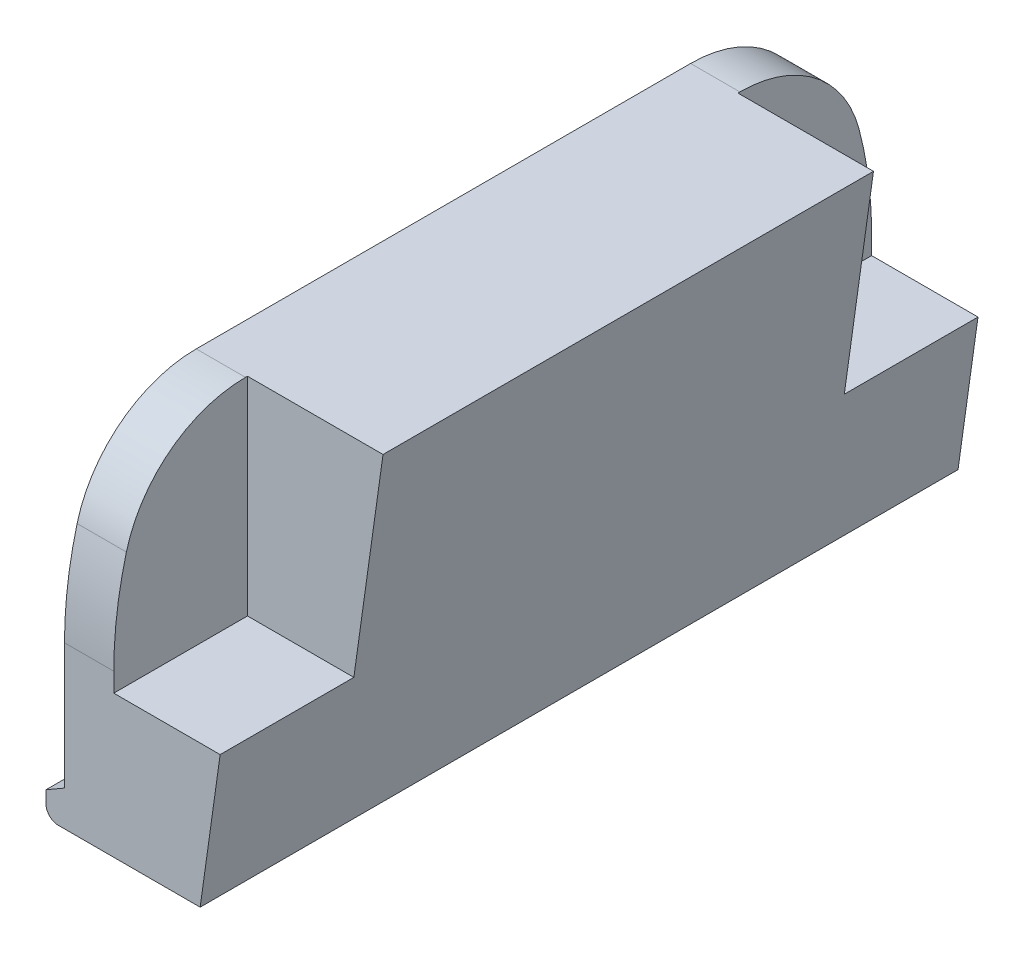
from build123d import *

# Parameters (mm, degrees)
BOSS_EXTRUDE1_DEPTH = 12.3
SKETCH2_W           = 2.2
SKETCH2_H           = 2.17
CUT_EXTRUDE1_DEPTH  = 4.2
CUT_EXTRUDE3_DEPTH  = 0.8
SKETCH5_W           = 3
SKETCH5_H           = 1
BOSS_EXTRUDE2_DEPTH = 0.55
BOSS_EXTRUDE3_DEPTH = 3
SKETCH7_W           = 13.013136742
SKETCH7_H           = 0.83
CUT_EXTRUDE4_DEPTH  = 15.056708453
FILLET1_R           = 2
CUT_EXTRUDE5_DEPTH  = 14.785193345


with BuildPart() as part:
    # Sketch1 → Boss-Extrude1 (new body)
    with BuildSketch(Plane.XY):
        with BuildLine():
            Line((0, 0), (0.299997713, 0.173208719))
            Line((0.299997713, 0.173208719), (0.299997713, 1.781598719))
            Line((0.299997713, 1.781598719), (0.299997713, 6.107458719))
            Line((0.299997713, 6.107458719), (3.299997713, 6.107458719))
            Line((3.299997713, 6.107458719), (3.299997713, 0.646828719))
            Line((3.299997713, 0.646828719), (3.299997713, -0.4))
            Line((3.299997713, -0.4), (0.2, -0.4))
            ThreePointArc((0.2, -0.4), (0.058578644, -0.341421356), (0, -0.2))
            Line((0, -0.2), (0, 0))
        make_face()
    extrude(amount=BOSS_EXTRUDE1_DEPTH)

    # Sketch2 → Cut-Extrude1 (cut)
    with BuildSketch(Plane(origin=(0, 6.107458719, 0), x_dir=(1, 0, 0), z_dir=(0, 1, 0))):
        with Locations((2.199997713, -1.085)):
            Rectangle(SKETCH2_W, SKETCH2_H)
        with Locations((2.199997713, -11.215)):
            Rectangle(SKETCH2_W, SKETCH2_H)
    extrude(amount=-CUT_EXTRUDE1_DEPTH, mode=Mode.SUBTRACT)

    # Sketch4 → Cut-Extrude3 (cut)
    with BuildSketch(Plane.ZY.offset(-0.299997713)):
        with BuildLine():
            Line((10.41158, 6.107458719), (12.3, 6.107458719))
            Line((12.3, 6.107458719), (12.3, 2.215929667))
            ThreePointArc((12.3, 2.215929667), (12.02880398, 4.022129667), (11.23913234, 5.669043272))
            ThreePointArc((11.23913234, 5.669043272), (10.879869522, 5.991150317), (10.41158, 6.107458719))
        make_face()
        with BuildLine():
            Line((1.88842, 6.107458719), (0, 6.107458719))
            Line((0, 6.107458719), (0, 2.215929667))
            ThreePointArc((0, 2.215929667), (0.27119602, 4.022129667), (1.06086766, 5.669043272))
            ThreePointArc((1.06086766, 5.669043272), (1.420130478, 5.991150317), (1.88842, 6.107458719))
        make_face()
    extrude(amount=-CUT_EXTRUDE3_DEPTH, mode=Mode.SUBTRACT)

    # Sketch5 → Boss-Extrude2 (add)
    with BuildSketch(Plane.ZY.offset(-0.299997713)):
        with Locations((6.15, 2.281598719)):
            Rectangle(SKETCH5_W, SKETCH5_H)
    extrude(amount=BOSS_EXTRUDE2_DEPTH)

    # Sketch6 → Boss-Extrude3 (add)
    with BuildSketch(Plane.XY.offset(7.65)):
        Polygon((0.299997713, 2.781598719), (0.299997713, 4.373208719), (-0.250002287, 2.781598719), align=None)
    extrude(amount=-BOSS_EXTRUDE3_DEPTH)

    # Sketch7 → Cut-Extrude4 (cut, through all)
    with BuildSketch(Plane.ZY.offset(-0.299997713)):
        with Locations((5.954326159, 5.69245873)):
            Rectangle(SKETCH7_W, SKETCH7_H)
    extrude(amount=-CUT_EXTRUDE4_DEPTH, mode=Mode.SUBTRACT)

    # Fillet1
    fillet1_edges = [part.edges().sort_by_distance(p)[0] for p in [
        (0.699997713, 5.27745873, 0.816134079),
        (0.699997713, 5.27745873, 11.483865921),
    ]]
    fillet(fillet1_edges, radius=FILLET1_R)

    # Sketch8 → Cut-Extrude5 (cut, through all)
    with BuildSketch(Plane.XY.offset(12.3)):
        Polygon((3.299997713, -0.4), (2.502082924, -0.4), (3.299997713, 5.27745873), align=None)
    extrude(amount=-CUT_EXTRUDE5_DEPTH, mode=Mode.SUBTRACT)


solid = part.part
